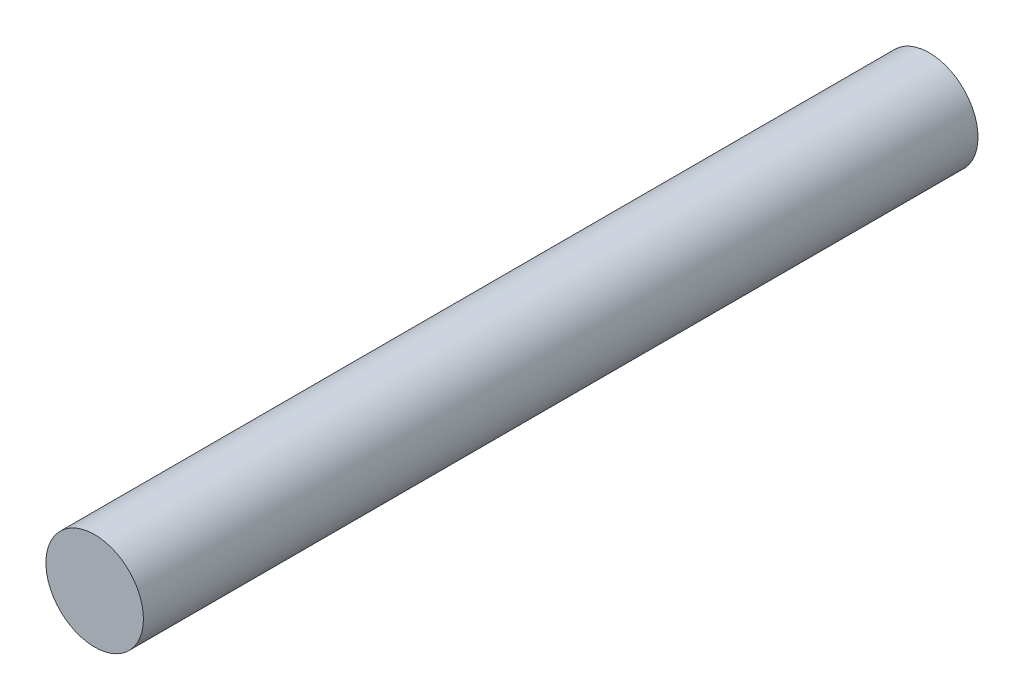
from build123d import *

# Parameters (mm, degrees)
SKETCH1_R           = 1.25
BOSS_EXTRUDE1_DEPTH = 21.4


with BuildPart() as part:
    # Sketch1 → Boss-Extrude1 (new body)
    with BuildSketch(Plane.XY):
        Circle(SKETCH1_R)
    extrude(amount=BOSS_EXTRUDE1_DEPTH)


solid = part.part
